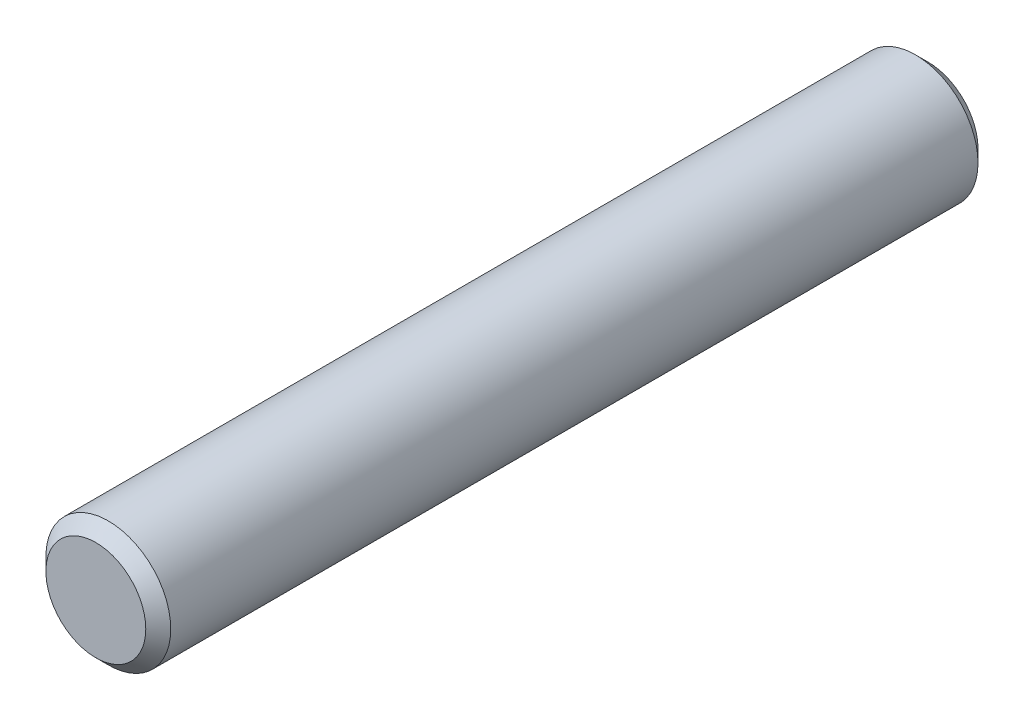
from build123d import *

# Parameters (mm, degrees)
SKETCH1_R           = 1.5
BOSS_EXTRUDE1_DEPTH = 10
CHAMFER1_SIZE       = 0.3


with BuildPart() as part:
    # Sketch1 → Boss-Extrude1 (new, symmetric)
    with BuildSketch(Plane.XY):
        Circle(SKETCH1_R)
    extrude(amount=BOSS_EXTRUDE1_DEPTH, both=True)

    # Chamfer1
    chamfer1_edges = [part.edges().sort_by_distance(p)[0] for p in [
        (-1.5, 0, -10),
        (-1.5, 0, 10),
    ]]
    chamfer(chamfer1_edges, length=CHAMFER1_SIZE)


solid = part.part
